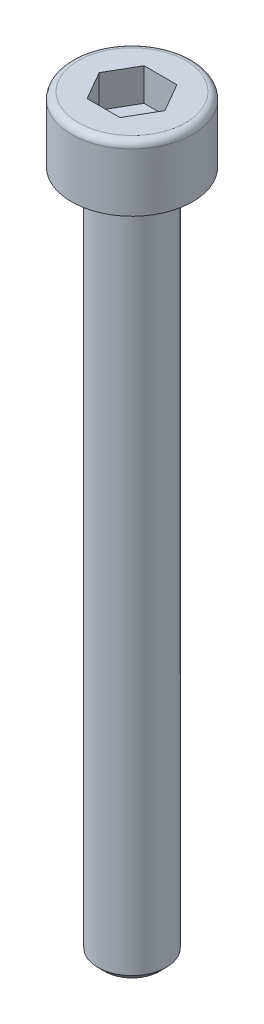
from build123d import *

# Parameters (mm, degrees)
CHAMFER1_SIZE      = 0.3
FILLET1_R          = 0.3
CUT_EXTRUDE1_DEPTH = 1.43


with BuildPart() as part:
    # Sketch1 → Revolve1 (revolve)
    with BuildSketch(Plane.XY, mode=Mode.PRIVATE) as revolve1_sk:
        Polygon((0, 0), (0, 2.86), (2.66, 2.86), (2.66, 0), (1.5, 0), (1.5, -30), (0, -30), align=None)
    revolve(revolve1_sk.sketch.rotate(Axis((0, 2.86, 0), (0, 1, 0)), 90), axis=Axis((0, 2.86, 0), (0, 1, 0)))

    # Chamfer1
    chamfer1_edges = [part.edges().sort_by_distance(p)[0] for p in [
        (0, -30, 1.5),
    ]]
    chamfer(chamfer1_edges, length=CHAMFER1_SIZE)

    # Fillet1
    fillet1_edges = [part.edges().sort_by_distance(p)[0] for p in [
        (0, 2.86, 2.66),
    ]]
    fillet(fillet1_edges, radius=FILLET1_R)

    # Sketch2 → Cut-Extrude1 (cut)
    with BuildSketch(Plane(origin=(0, 2.86, 0), x_dir=(1, 0, 0), z_dir=(0, 1, 0))):
        Polygon((0.721687836, -1.25), (1.443375673, 0), (0.721687836, 1.25), (-0.721687836, 1.25), (-1.443375673, 0), (-0.721687836, -1.25), align=None)
    extrude(amount=-CUT_EXTRUDE1_DEPTH, mode=Mode.SUBTRACT)


solid = part.part
